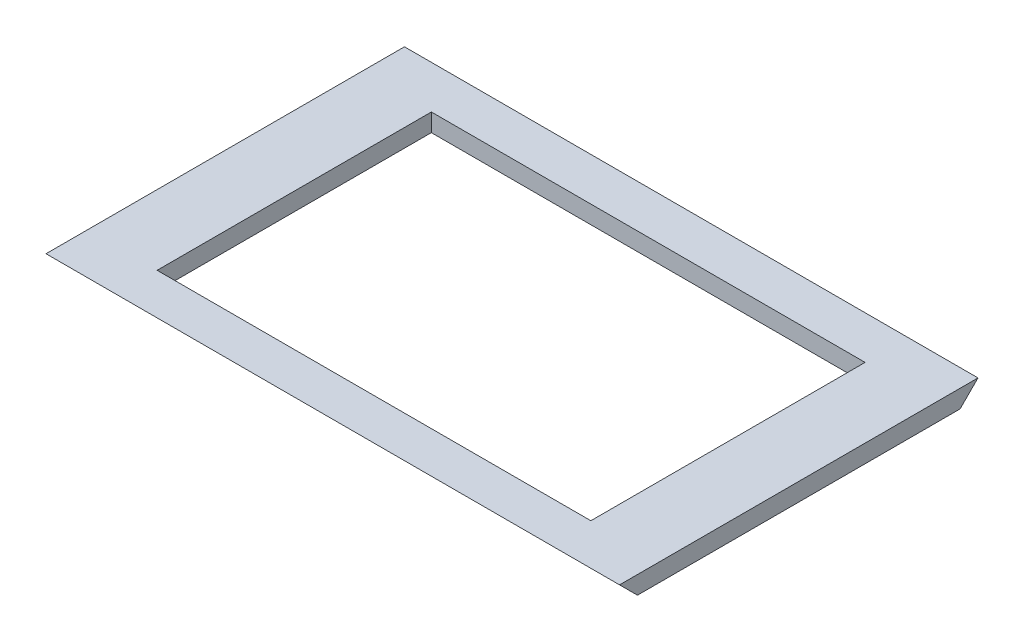
from build123d import *

# Parameters (mm, degrees)
SKETCH1_W           = 100
SKETCH1_H           = 5
BOSS_EXTRUDE1_DEPTH = 300
CUT_EXTRUDE1_DEPTH  = 300
SKETCH3_W           = 121
SKETCH3_H           = 76.5
CUT_EXTRUDE2_DEPTH  = 5
CUT_EXTRUDE3_DEPTH  = 300
SKETCH5_W           = 70
SKETCH5_H           = 100
CUT_EXTRUDE4_DEPTH  = 5


with BuildPart() as part:
    # Sketch1 → Boss-Extrude1 (new body)
    with BuildSketch(Plane(origin=(0, 0, 0), x_dir=(0, 0, -1), z_dir=(1, 0, 0))):
        Rectangle(SKETCH1_W, SKETCH1_H)
    extrude(amount=BOSS_EXTRUDE1_DEPTH)

    # Sketch2 → Cut-Extrude1 (cut)
    with BuildSketch(Plane(origin=(300, 0, 0), x_dir=(0, 0, -1), z_dir=(1, 0, 0))):
        Polygon((-50, 2.5), (-45, -2.5), (-50, -2.5), align=None)
    extrude(amount=-CUT_EXTRUDE1_DEPTH, mode=Mode.SUBTRACT)

    # Sketch3 → Cut-Extrude2 (cut)
    with BuildSketch(Plane(origin=(0, 2.5, 0), x_dir=(1, 0, 0), z_dir=(0, 1, 0))):
        with Locations((150, -0.25)):
            Rectangle(SKETCH3_W, SKETCH3_H)
    extrude(amount=-CUT_EXTRUDE2_DEPTH, mode=Mode.SUBTRACT)

    # Sketch4 → Cut-Extrude3 (cut)
    with BuildSketch(Plane(origin=(300, 0, 0), x_dir=(0, 0, -1), z_dir=(1, 0, 0))):
        Polygon((50, 2.5), (45, -2.5), (50, -2.5), align=None)
    extrude(amount=-CUT_EXTRUDE3_DEPTH, mode=Mode.SUBTRACT)

    # Sketch5 → Cut-Extrude4 (cut)
    with BuildSketch(Plane(origin=(0, 2.5, 0), x_dir=(1, 0, 0), z_dir=(0, 1, 0))):
        with Locations((35, 0)):
            Rectangle(SKETCH5_W, SKETCH5_H)
        with Locations((265, 0)):
            Rectangle(SKETCH5_W, SKETCH5_H)
    extrude(amount=-CUT_EXTRUDE4_DEPTH, mode=Mode.SUBTRACT)


solid = part.part
